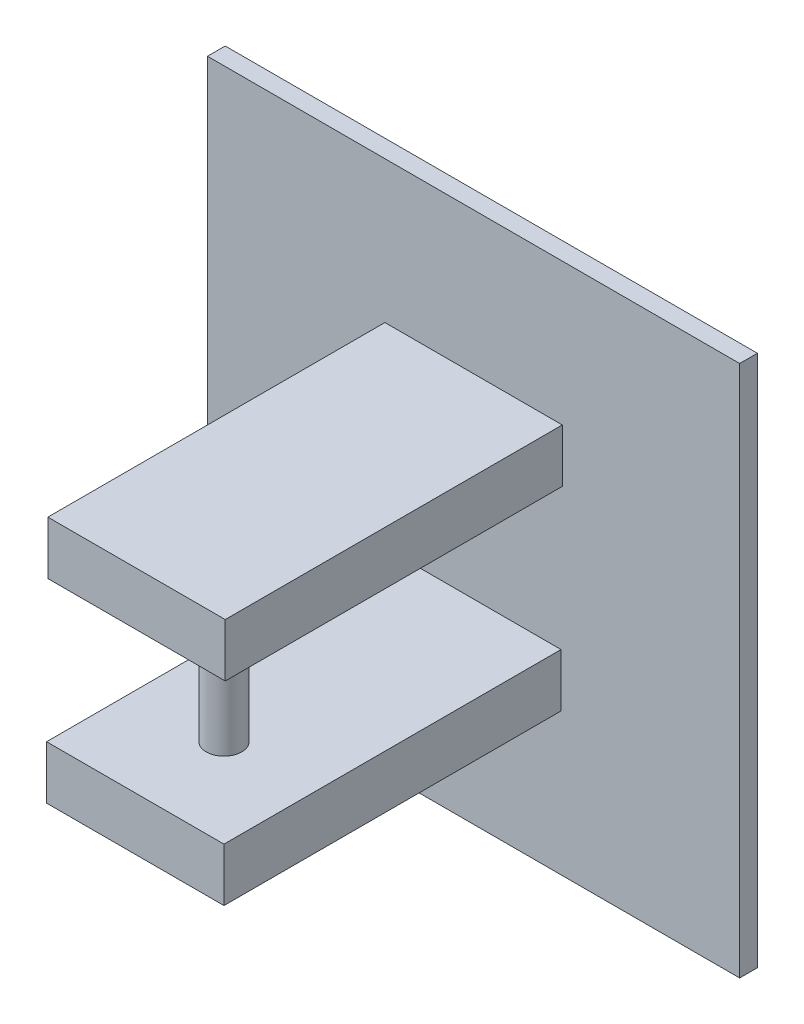
from build123d import *

# Parameters (mm, degrees)
SCHIZZO2_W                   = 150
SCHIZZO2_H                   = 150
ESTRUSIONE_ESTRUSIONE1_DEPTH = 5
SCHIZZO3_W                   = 50
SCHIZZO3_H                   = 15
ESTRUSIONE_ESTRUSIONE2_DEPTH = 95
SCHIZZO6_R                   = 5
ESTRUSIONE_ESTRUSIONE3_DEPTH = 61.630141236


with BuildPart() as part:
    # Schizzo2 → Estrusione-Estrusione1 (new body)
    with BuildSketch(Plane.XY):
        with Locations((75, 75)):
            Rectangle(SCHIZZO2_W, SCHIZZO2_H)
    extrude(amount=-ESTRUSIONE_ESTRUSIONE1_DEPTH)

    # Schizzo3 → Estrusione-Estrusione2 (add)
    with BuildSketch(Plane.XY):
        with Locations((74.643012927, 47.5)):
            Rectangle(SCHIZZO3_W, SCHIZZO3_H)
        with Locations((75, 102.5)):
            Rectangle(SCHIZZO3_W, SCHIZZO3_H)
    extrude(amount=ESTRUSIONE_ESTRUSIONE2_DEPTH)

    # Schizzo6 → Estrusione-Estrusione3 (add)
    with BuildSketch(Plane.XZ.offset(-40)):
        with Locations(Location((74.643012927, 70, 0), (0, 0, 270))):
            Circle(SCHIZZO6_R)
    extrude(amount=-ESTRUSIONE_ESTRUSIONE3_DEPTH)


solid = part.part
